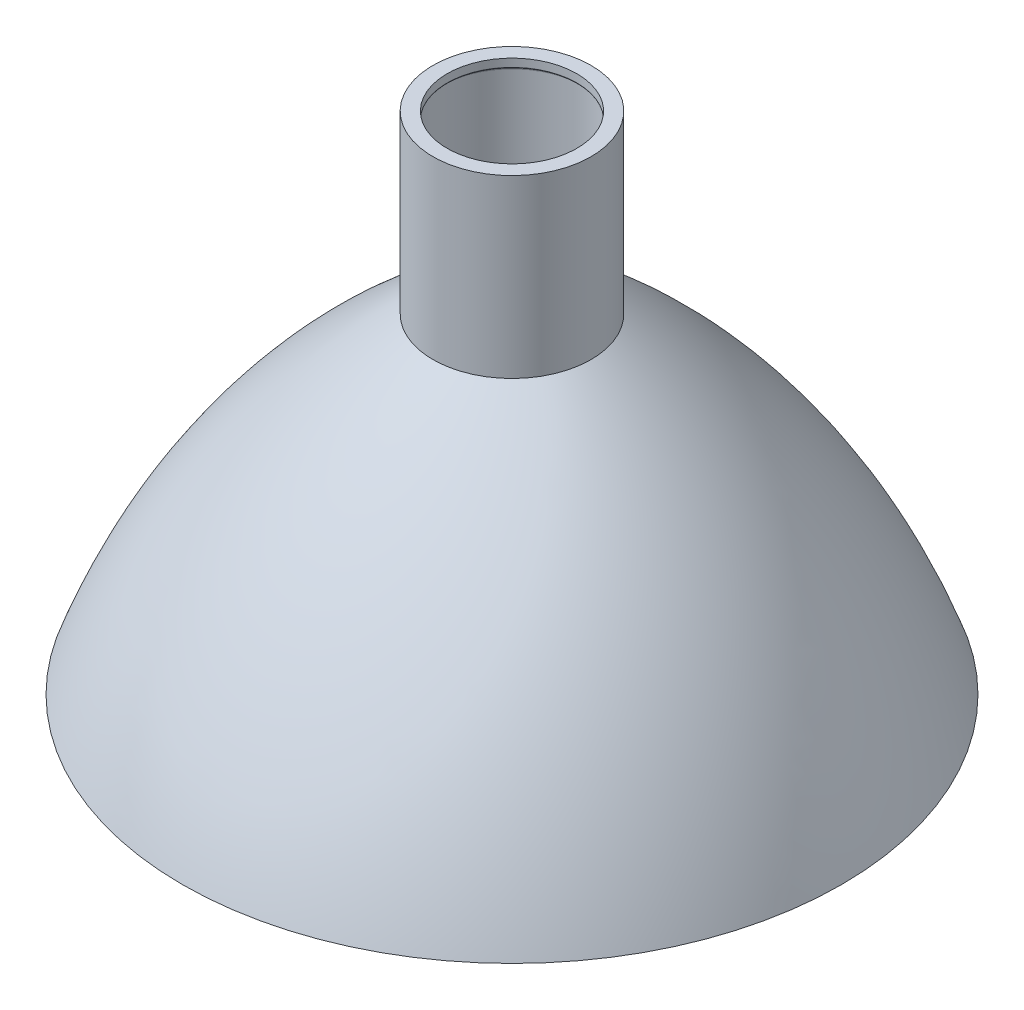
from build123d import *


with BuildPart() as part:
    # Sketch1 → Revolve1 (revolve)
    with BuildSketch(Plane.XY, mode=Mode.PRIVATE) as revolve1_sk:
        with BuildLine():
            add(Edge.make_bspline(
                [(-75, 0), (-58.406274113, 46.597036045), (-18, 75)],
                knots=[0, 0, 0, 1, 1, 1], degree=2))
            Line((-75, 0), (-73, 0))
            add(Edge.make_bspline(
                [(-73, 0), (-55.203968241, 45.604593249), (-16, 75)],
                knots=[0, 0, 0, 1, 1, 1], degree=2))
            Line((-16, 75), (-16, 112))
            ThreePointArc((-16, 112), (-15.707106781, 112.707106781), (-15, 113))
            Line((-15, 113), (-14.95, 113))
            ThreePointArc((-14.95, 113), (-14.808578644, 113.058578644), (-14.75, 113.2))
            Line((-14.75, 113.2), (-14.75, 115))
            Line((-14.75, 115), (-18, 115))
            Line((-18, 115), (-18, 75))
        make_face()
        with BuildLine():
            add(Edge.make_bspline(
                [(73, 0), (55.203968241, 45.604593249), (16, 75)],
                knots=[0, 0, 0, 1, 1, 1], degree=2))
            Line((73, 0), (75, 0))
            add(Edge.make_bspline(
                [(75, 0), (58.406274113, 46.597036045), (18, 75)],
                knots=[0, 0, 0, 1, 1, 1], degree=2))
            Line((18, 75), (18, 115))
            Line((18, 115), (14.75, 115))
            Line((14.75, 115), (14.75, 113.2))
            ThreePointArc((14.75, 113.2), (14.808578644, 113.058578644), (14.95, 113))
            Line((14.95, 113), (15, 113))
            ThreePointArc((15, 113), (15.707106781, 112.707106781), (16, 112))
            Line((16, 112), (16, 75))
        make_face()
    revolve(revolve1_sk.sketch.rotate(Axis((0, 0, 0), (0, 1, 0)), 270), axis=Axis((0, 0, 0), (0, 1, 0)))


solid = part.part
